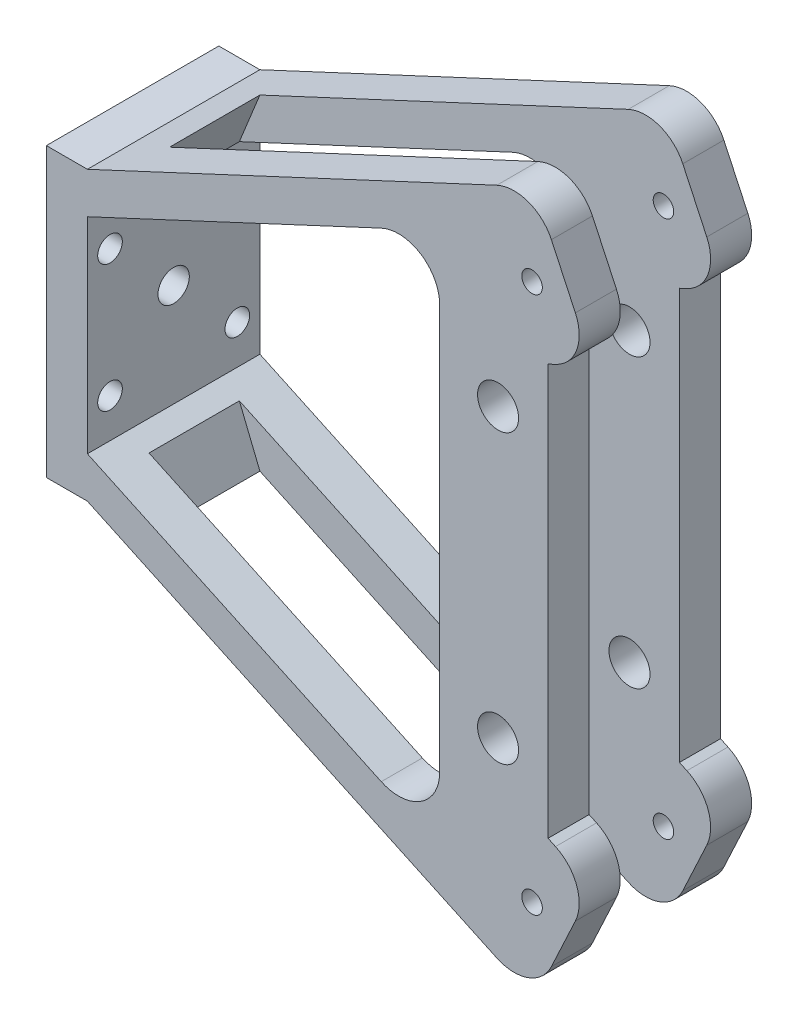
from build123d import *

# Parameters (mm, degrees)
SKETCH_1_W                  = 42
SKETCH_1_H                  = 70
SKETCH_1_R                  = 3.815643184
EXTRUDE_1_DEPTH             = 10
SKETCH_2_R                  = 5
SKETCH_2_R_2                = 2.5
EXTRUDE_2_DEPTH             = 10
MIRROR_23_COPY_1_SKETCH_R   = 5
MIRROR_23_COPY_1_SKETCH_R_2 = 2.5
MIRROR_23_COPY_1_DEPTH      = 10
SKETCH_3_R                  = 3
CUT_EXTRUDE_1_DEPTH         = 5
SKETCH_4_R                  = 1.5
CUT_EXTRUDE_2_DEPTH         = 151.99366476
EXTRUDE_3_DEPTH             = 11


with BuildPart() as part:
    # 草图1 → 凸台-拉伸1 (new body)
    with BuildSketch(Plane(origin=(-10, 0, 0), x_dir=(0, 0, -1), z_dir=(1, 0, 0))):
        Rectangle(SKETCH_1_W, SKETCH_1_H)
        Circle(SKETCH_1_R, mode=Mode.SUBTRACT)
    extrude_1 = extrude(amount=EXTRUDE_1_DEPTH)


with BuildPart() as body_2:
    # 草图2 → 凸台-拉伸2 (new body)
    with BuildSketch(Plane.XY.offset(21)):
        with BuildLine():
            Line((0, 35), (99.693856574, 81.488008791))
            ThreePointArc((99.693856574, 81.488008791), (107.340240625, 81.821857129), (112.983117062, 76.651113539))
            Line((112.983117062, 76.651113539), (118.819711203, 64.134497011))
            ThreePointArc((118.819711203, 64.134497011), (119.15355954, 56.488112961), (113.98281595, 50.845236523))
            Line((113.98281595, 50.845236523), (112.170200376, 50))
            Line((112.170200376, 50), (112.170200376, 0))
            Line((112.170200376, 0), (85.78027682, 0))
            Line((85.78027682, 0), (85.78027682, 49.303144229))
            ThreePointArc((85.78027682, 49.303144229), (81.153272904, 57.737058687), (71.554094203, 58.366222099))
            Line((71.554094203, 58.366222099), (0, 25))
            Line((0, 25), (0, 35))
        make_face()
        with Locations((100, 35)):
            Circle(SKETCH_2_R, mode=Mode.SUBTRACT)
        with Locations((108.27716468, 65.429340608)):
            Circle(SKETCH_2_R_2, mode=Mode.SUBTRACT)
    extrude_2 = extrude(amount=-EXTRUDE_2_DEPTH)


with BuildPart() as part_1:
    add(part.part)

    add(body_2.part)  # 镜向5 merges body 2
    # 镜向5: 凸台-拉伸2 across plane
    add(extrude_2.mirror(Plane.ZX))

    # 镜向23: 凸台-拉伸1, 凸台-拉伸2 across plane
    add(extrude_1.mirror(Plane.XY))
    add(extrude_2.mirror(Plane.XY))

    # 镜向23 copy 1 sketch → 镜向23 copy 1 (add)
    with BuildSketch(Plane(origin=(0, 0, -21), x_dir=(1, 0, 0), z_dir=(0, 0, -1))):
        with BuildLine():
            Line((0, 35), (99.693856574, 81.488008791))
            ThreePointArc((99.693856574, 81.488008791), (107.340240625, 81.821857129), (112.983117062, 76.651113539))
            Line((112.983117062, 76.651113539), (118.819711203, 64.134497011))
            ThreePointArc((118.819711203, 64.134497011), (119.15355954, 56.488112961), (113.98281595, 50.845236523))
            Line((113.98281595, 50.845236523), (112.170200376, 50))
            Line((112.170200376, 50), (112.170200376, 0))
            Line((112.170200376, 0), (85.78027682, 0))
            Line((85.78027682, 0), (85.78027682, 49.303144229))
            ThreePointArc((85.78027682, 49.303144229), (81.153272904, 57.737058687), (71.554094203, 58.366222099))
            Line((71.554094203, 58.366222099), (0, 25))
            Line((0, 25), (0, 35))
        make_face()
        with Locations((100, 35)):
            Circle(MIRROR_23_COPY_1_SKETCH_R, mode=Mode.SUBTRACT)
        with Locations((108.27716468, 65.429340608)):
            Circle(MIRROR_23_COPY_1_SKETCH_R_2, mode=Mode.SUBTRACT)
    extrude(amount=-MIRROR_23_COPY_1_DEPTH)

    # 草图3 → 切除-拉伸1 (cut)
    with BuildSketch(Plane(origin=(0, 0, 0), x_dir=(0, 0, -1), z_dir=(1, 0, 0))):
        with Locations((15.5, 15.5)):
            Circle(SKETCH_3_R)
        with Locations((15.5, -15.5)):
            Circle(SKETCH_3_R)
        with Locations((-15.5, -15.5)):
            Circle(SKETCH_3_R)
        with Locations((-15.5, 15.5)):
            Circle(SKETCH_3_R)
    extrude(amount=-CUT_EXTRUDE_1_DEPTH, mode=Mode.SUBTRACT)

    # 草图4 → 切除-拉伸2 (cut, through all)
    with BuildSketch(Plane(origin=(-5, 0, 0), x_dir=(0, 0, -1), z_dir=(1, 0, 0))):
        with Locations((15.5, 15.5)):
            Circle(SKETCH_4_R)
        with Locations((-15.5, 15.5)):
            Circle(SKETCH_4_R)
        with Locations((-15.5, -15.5)):
            Circle(SKETCH_4_R)
        with Locations((15.5, -15.5)):
            Circle(SKETCH_4_R)
    extrude(amount=-CUT_EXTRUDE_2_DEPTH, mode=Mode.SUBTRACT)

    # 草图5 → 凸台-拉伸3 (add, symmetric)
    with BuildSketch(Plane.XY):
        Polygon((0, 35), (0, 25), (5, 27.331538291), (10, 39.663076582), align=None)
    extrude_3 = extrude(amount=EXTRUDE_3_DEPTH, both=True)

    # 镜向24: 凸台-拉伸3 across plane
    add(extrude_3.mirror(Plane.ZX))


solid = part_1.part
